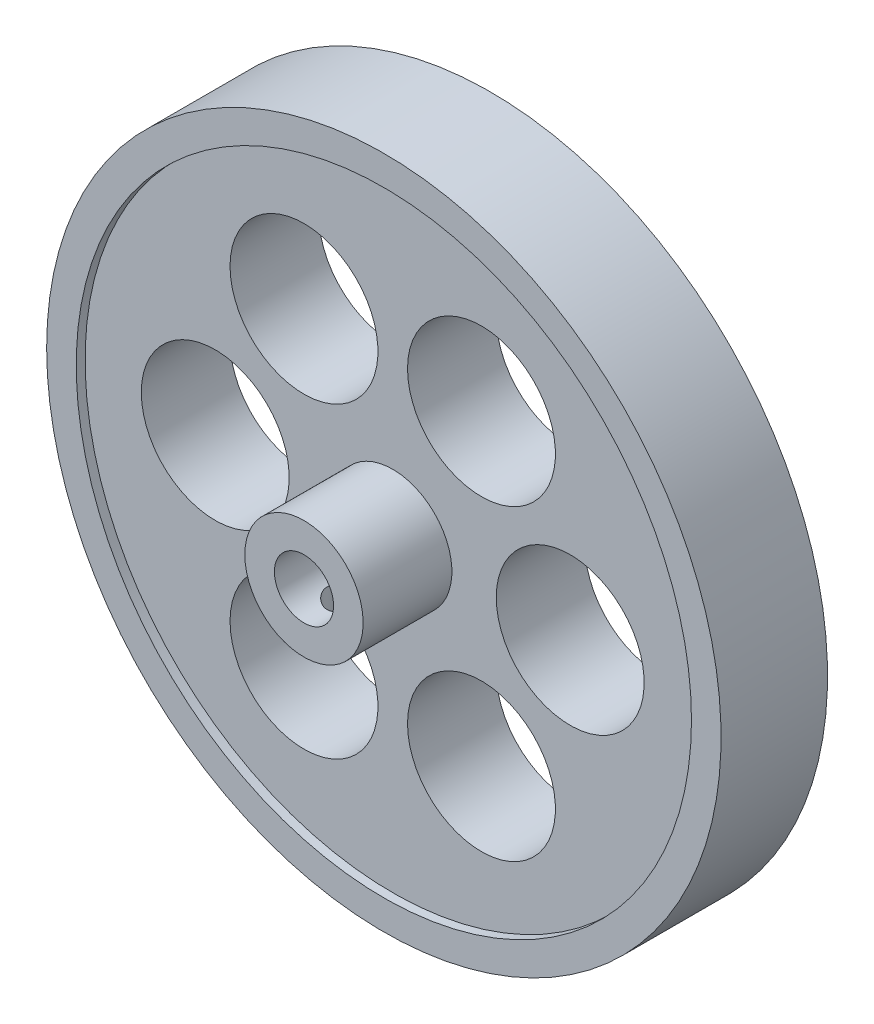
from build123d import *

# Parameters (mm, degrees)
SKETCH_1_W                   = 57
SKETCH_1_H                   = 18
HOLE_WIZARD_M100_1_D         = 104
HOLE_WIZARD_M100_1_DEPTH     = 1.5
SKETCH_4_W                   = 10
SKETCH_4_H                   = 15
HOLE_WIZARD_M8_1_D           = 10
HOLE_WIZARD_M8_1_CBORE_D     = 104
HOLE_WIZARD_M8_1_CBORE_DEPTH = 1.5
HOLE_WIZARD_5_2_5_2_1_REACH  = 93.449
HOLE_WIZARD_5_2_5_2_1_BORE_R = 2.6
HOLE_WIZARD_25_0_25_1_D      = 25
HOLE_WIZARD_25_0_25_1_DEPTH  = 30


with BuildPart() as part:
    # 草图1 → 旋转1 (revolve)
    with BuildSketch(Plane.XZ, mode=Mode.PRIVATE) as revolve_1_sk:
        with Locations((28.5, 0)):
            Rectangle(SKETCH_1_W, SKETCH_1_H)
    revolve(revolve_1_sk.sketch.rotate(Axis((0, 0, 9), (0, 0, -1)), 180), axis=Axis((0, 0, 9), (0, 0, -1)))

    # M100 间隙孔1
    with Locations(Plane.XY.offset(9)):
        with Locations((0, 0)):
            Hole(HOLE_WIZARD_M100_1_D / 2, depth=HOLE_WIZARD_M100_1_DEPTH)

    # 草图4 → 旋转2 (revolve)
    with BuildSketch(Plane.XZ):
        with Locations((5, 15)):
            Rectangle(SKETCH_4_W, SKETCH_4_H)
    revolve(axis=Axis((0, 0, 22.5), (0, 0, -1)))

    # M8 六角头螺栓的柱形沉头孔1 (through all)
    with Locations(Plane(origin=(0, 0, -9), x_dir=(-1, 0, 0), z_dir=(0, 0, -1))):
        with Locations((0, 0)):
            CounterBoreHole(HOLE_WIZARD_M8_1_D / 2, HOLE_WIZARD_M8_1_CBORE_D / 2, HOLE_WIZARD_M8_1_CBORE_DEPTH)

    # Ø5.2 (5.2) 直径孔1 bore (on position points) → Ø5.2 (5.2) 直径孔1 (cut, up to next)
    with BuildSketch(Plane(origin=(0, -10, 16), x_dir=(-1, 0, 0), z_dir=(0, -1, 0)), mode=Mode.PRIVATE) as hole_wizard_5_2_5_2_1_sk1:
        Circle(HOLE_WIZARD_5_2_5_2_1_BORE_R)
    hole_wizard_5_2_5_2_1_tool1 = extrude(hole_wizard_5_2_5_2_1_sk1.sketch, amount=-HOLE_WIZARD_5_2_5_2_1_REACH, mode=Mode.PRIVATE) & part.part
    add(hole_wizard_5_2_5_2_1_tool1.solids().sort_by_distance((0, -10, 16))[0], mode=Mode.SUBTRACT)

    # Ø25.0 (25) 直径孔1
    with Locations(Plane(origin=(0, 0, -7.5), x_dir=(-1, 0, 0), z_dir=(0, 0, -1))):
        with Locations((-30, 0), (-15, 25.980762114), (15, 25.980762114), (30, 0), (15, -25.980762114), (-15, -25.980762114)):
            Hole(HOLE_WIZARD_25_0_25_1_D / 2, depth=HOLE_WIZARD_25_0_25_1_DEPTH)


solid = part.part
